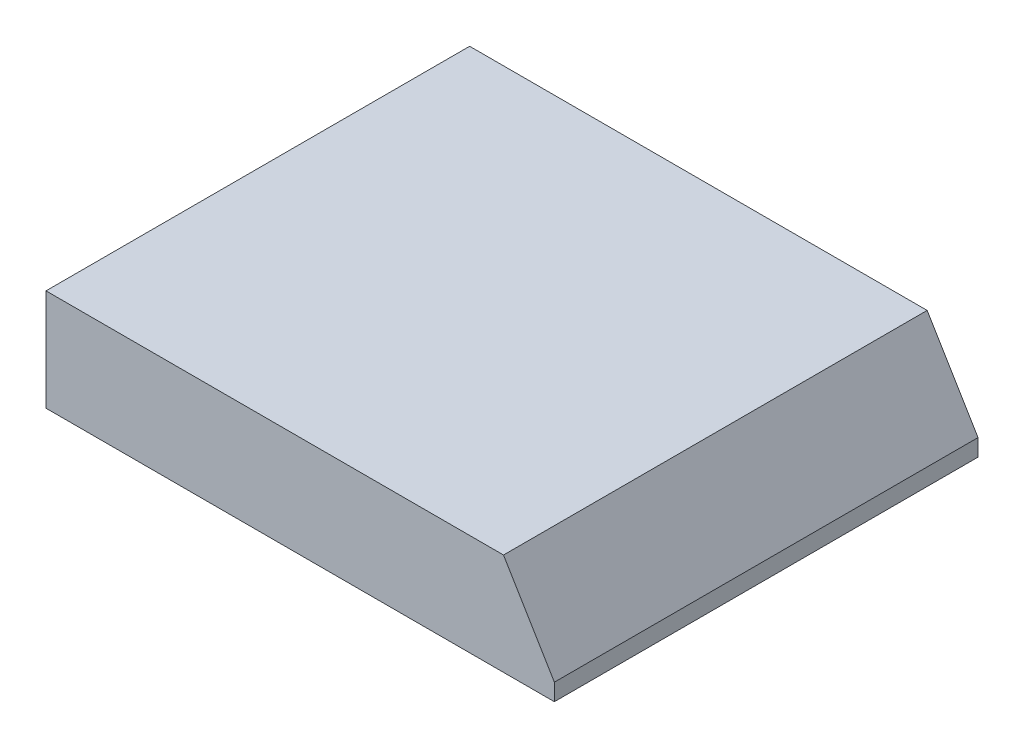
from build123d import *

# Parameters (mm, degrees)
SKETCH1_W           = 60
SKETCH1_H           = 12
BOSS_EXTRUDE1_DEPTH = 50
CUT_EXTRUDE1_DEPTH  = 80.018985061


with BuildPart() as part:
    # Sketch1 → Boss-Extrude1 (new body)
    with BuildSketch(Plane.XY):
        with Locations((30, 6)):
            Rectangle(SKETCH1_W, SKETCH1_H)
    extrude(amount=BOSS_EXTRUDE1_DEPTH)

    # Sketch2 → Cut-Extrude1 (cut, through all)
    with BuildSketch(Plane.XY.offset(50)):
        Polygon((54, 12), (60, 2), (60, 12), align=None)
    extrude(amount=-CUT_EXTRUDE1_DEPTH, mode=Mode.SUBTRACT)


solid = part.part
